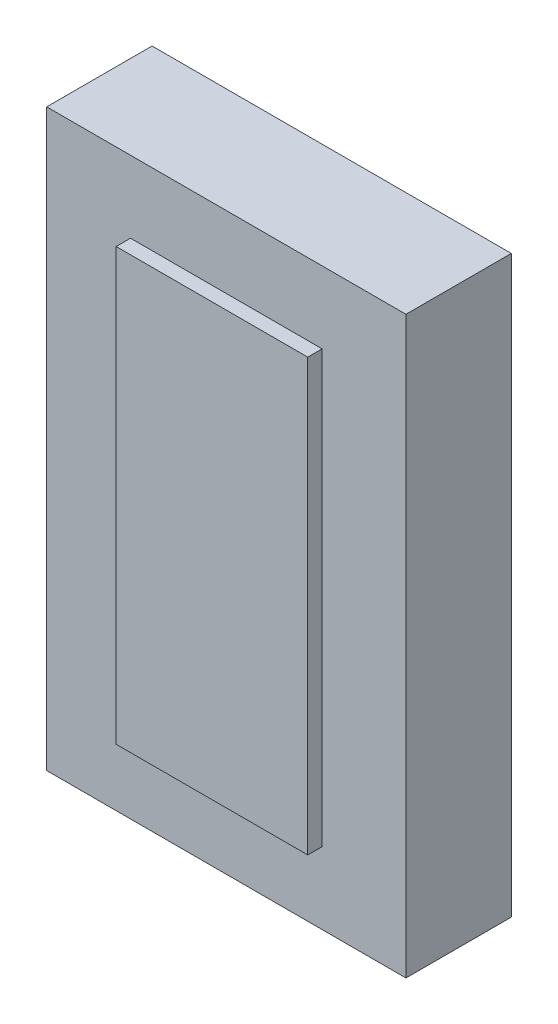
from build123d import *

# Parameters (mm, degrees)
SKETCH1_W           = 75
SKETCH1_H           = 120
BOSS_EXTRUDE1_DEPTH = 22
SKETCH3_W           = 40
SKETCH3_H           = 90
BOSS_EXTRUDE2_DEPTH = 25


with BuildPart() as part:
    # Sketch1 → Boss-Extrude1 (new body)
    with BuildSketch(Plane.XY):
        Rectangle(SKETCH1_W, SKETCH1_H)
    extrude(amount=BOSS_EXTRUDE1_DEPTH)

    # Sketch3 → Boss-Extrude2 (add)
    with BuildSketch(Plane.XY):
        Rectangle(SKETCH3_W, SKETCH3_H)
    extrude(amount=BOSS_EXTRUDE2_DEPTH)


solid = part.part
